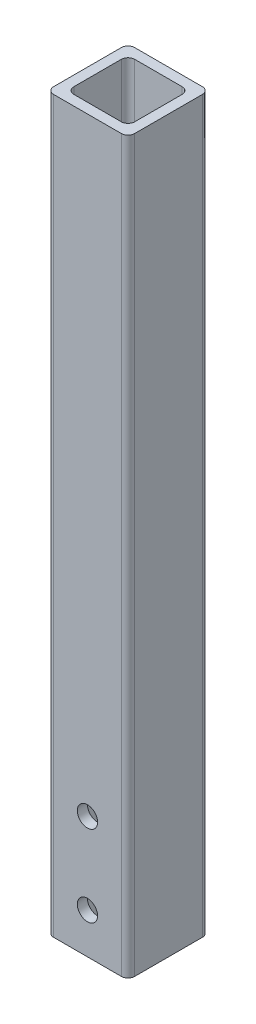
from build123d import *

# Parameters (mm, degrees)
SKETCH1_W               = 25.4
SKETCH1_H               = 25.4
SKETCH1_W_2             = 19.05
SKETCH1_H_2             = 19.05
BOSS_EXTRUDE1_DEPTH     = 1219.2
FILLET1_R               = 2.1082
SKETCH2_OUTSIDE_W       = 271.346
SKETCH2_OUTSIDE_H       = 1465.146
SKETCH2_OUTSIDE_W_2     = 161.404490431
SKETCH2_OUTSIDE_H_2     = 228.6
CUT_EXTRUDE1_DEPTH      = 1220.530684321
CUT_EXTRUDE3_DEPTH      = 231.35713577
CUT_EXTRUDE3_DEPTH_BACK = 231.35713577
SKETCH5_R               = 3.175


with BuildPart() as part:
    # Sketch1 → Boss-Extrude1 (new body)
    with BuildSketch(Plane(origin=(0, 0, 0), x_dir=(1, 0, 0), z_dir=(0, 1, 0))):
        Rectangle(SKETCH1_W, SKETCH1_H)
        Rectangle(SKETCH1_W_2, SKETCH1_H_2, mode=Mode.SUBTRACT)
    extrude(amount=BOSS_EXTRUDE1_DEPTH)

    # Fillet1
    fillet1_edges = [part.edges().sort_by_distance(p)[0] for p in [
        (9.525, 609.6, 9.525),
        (9.525, 609.6, -9.525),
        (-9.525, 609.6, -9.525),
        (-9.525, 609.6, 9.525),
        (-12.7, 609.6, -12.7),
        (12.7, 609.6, -12.7),
        (12.7, 609.6, 12.7),
        (-12.7, 609.6, 12.7),
    ]]
    fillet(fillet1_edges, radius=FILLET1_R)

    # Sketch2 outside → Cut-Extrude1 (cut, through all)
    with BuildSketch(Plane(origin=(12.7, 0, 0), x_dir=(0, 0, -1), z_dir=(1, 0, 0))):
        with Locations((0, 609.6)):
            Rectangle(SKETCH2_OUTSIDE_W, SKETCH2_OUTSIDE_H)
        with Locations((42.327264621, 114.3)):
            Rectangle(SKETCH2_OUTSIDE_W_2, SKETCH2_OUTSIDE_H_2, mode=Mode.SUBTRACT)
    extrude(amount=-CUT_EXTRUDE1_DEPTH, mode=Mode.SUBTRACT)

    # Sketch5 → Cut-Extrude3 (cut, two sides: drawn at the far end of the back side and taken through both)
    with BuildSketch(Plane.XY.offset(12.7).offset(-CUT_EXTRUDE3_DEPTH_BACK)):
        with Locations((0, 12.7)):
            Circle(SKETCH5_R)
        with Locations((0, 38.1)):
            Circle(SKETCH5_R)
    extrude(amount=CUT_EXTRUDE3_DEPTH + CUT_EXTRUDE3_DEPTH_BACK, mode=Mode.SUBTRACT)


solid = part.part
